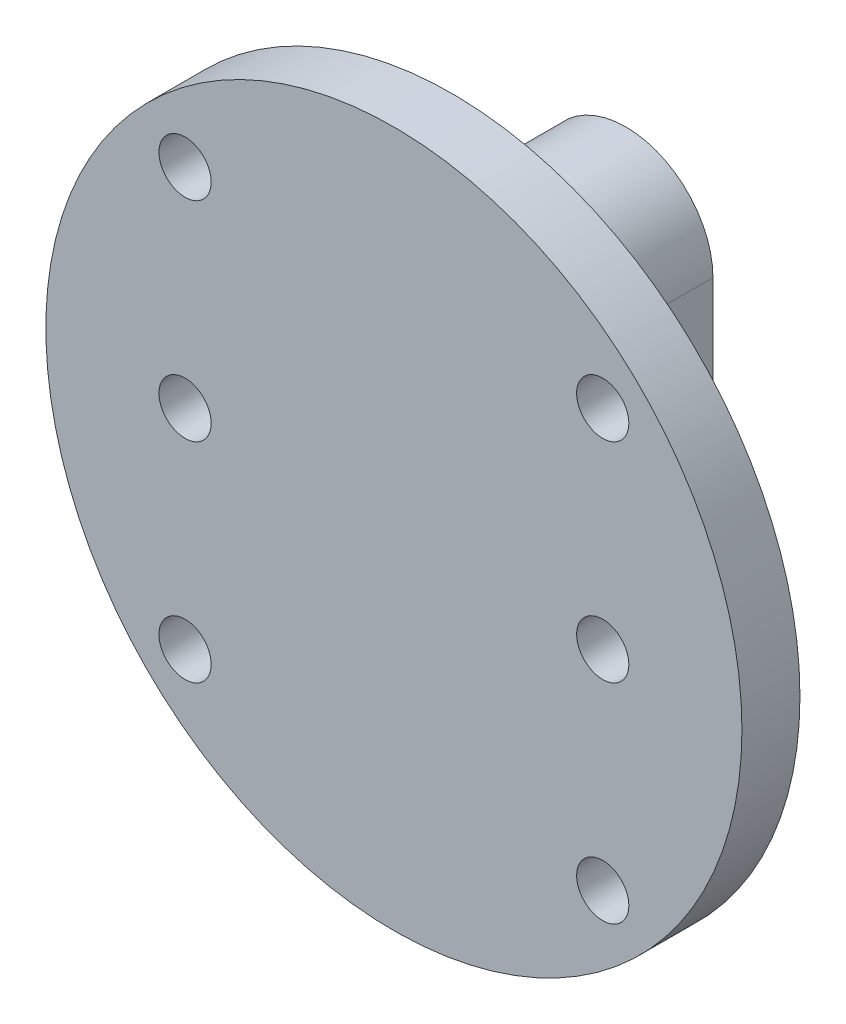
from build123d import *

# Parameters (mm, degrees)
ESQUISSE1_R        = 30
ESQUISSE1_R_2      = 2.25
BOSS_EXTRU_1_DEPTH = 5
ESQUISSE2_R        = 2.8
BOSS_EXTRU_2_DEPTH = 15


with BuildPart() as part:
    # Esquisse1 → Boss.-Extru.1 (new body)
    with BuildSketch(Plane.XY):
        Circle(ESQUISSE1_R)
        with Locations((18, 18)):
            Circle(ESQUISSE1_R_2, mode=Mode.SUBTRACT)
        with Locations((-18, 18)):
            Circle(ESQUISSE1_R_2, mode=Mode.SUBTRACT)
        with Locations((-18, -18)):
            Circle(ESQUISSE1_R_2, mode=Mode.SUBTRACT)
        with Locations((18, -18)):
            Circle(ESQUISSE1_R_2, mode=Mode.SUBTRACT)
        with Locations((18, 0)):
            Circle(ESQUISSE1_R_2, mode=Mode.SUBTRACT)
        with Locations((-18, 0)):
            Circle(ESQUISSE1_R_2, mode=Mode.SUBTRACT)
    extrude(amount=BOSS_EXTRU_1_DEPTH)

    # Esquisse2 → Boss.-Extru.2 (add)
    with BuildSketch(Plane(origin=(0, 0, 0), x_dir=(-1, 0, 0), z_dir=(0, 0, -1))):
        with BuildLine():
            Line((7.5, 12.5), (7.5, -12.5))
            ThreePointArc((7.5, -12.5), (0, -20), (-7.5, -12.5))
            Line((-7.5, -12.5), (-7.5, 12.5))
            ThreePointArc((-7.5, 12.5), (0, 20), (7.5, 12.5))
        make_face()
        with Locations((0, 12.5)):
            Circle(ESQUISSE2_R, mode=Mode.SUBTRACT)
        with Locations((0, -12.5)):
            Circle(ESQUISSE2_R, mode=Mode.SUBTRACT)
    extrude(amount=BOSS_EXTRU_2_DEPTH)


solid = part.part
